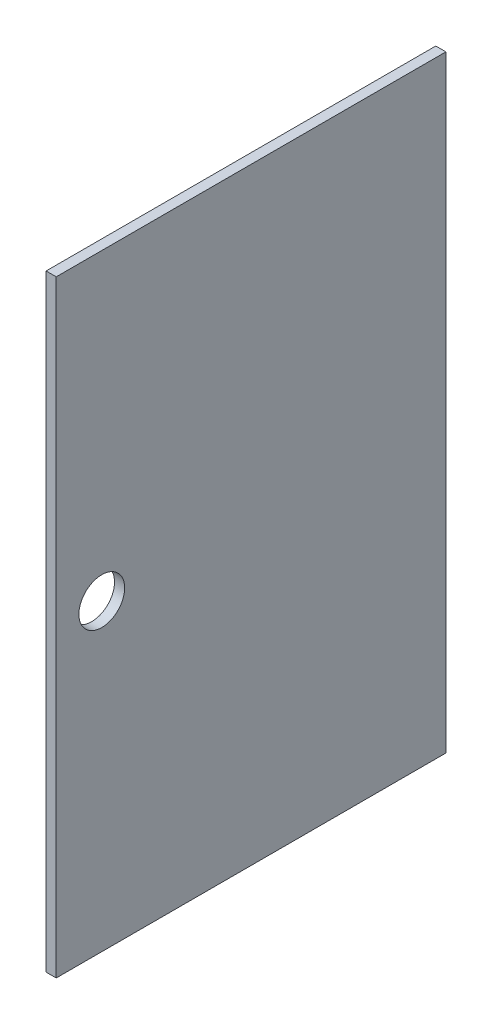
from build123d import *

# Parameters (mm, degrees)
SKETCH1_W           = 244.475
SKETCH1_H           = 381
SKETCH1_R           = 14.351
BOSS_EXTRUDE1_DEPTH = 6.35


with BuildPart() as part:
    # Sketch1 → Boss-Extrude1 (new body)
    with BuildSketch(Plane(origin=(0, 0, 0), x_dir=(0, 0, -1), z_dir=(1, 0, 0))):
        Rectangle(SKETCH1_W, SKETCH1_H)
        with Locations((-93.6625, 0)):
            Circle(SKETCH1_R, mode=Mode.SUBTRACT)
    extrude(amount=BOSS_EXTRUDE1_DEPTH)


solid = part.part
